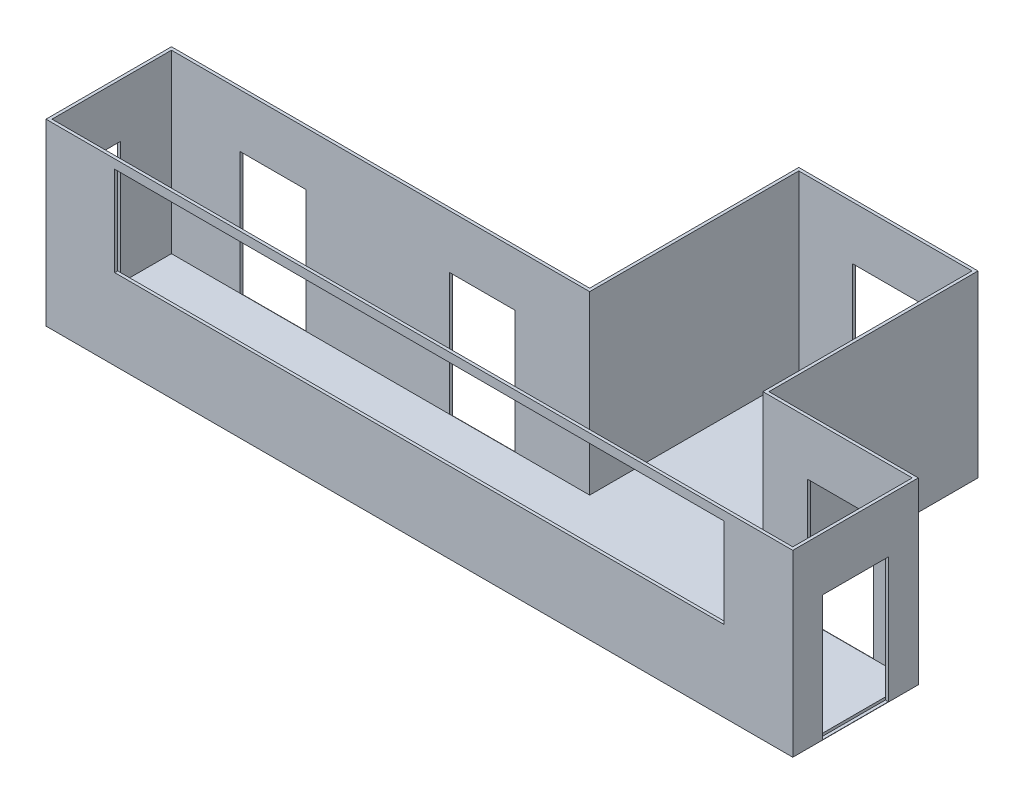
from build123d import *

# Parameters (mm, degrees)
BOSS_EXTRUDE1_DEPTH = 3000
SHELL1_T            = -50
SKETCH2_W           = 1100
SKETCH2_H           = 2100
CUT_EXTRUDE1_DEPTH  = 50
SKETCH3_W           = 1100
SKETCH3_H           = 2100
CUT_EXTRUDE2_DEPTH  = 50
SKETCH4_W           = 1100
SKETCH4_H           = 2100
CUT_EXTRUDE3_DEPTH  = 50
SKETCH5_W           = 1100
SKETCH5_H           = 2100
CUT_EXTRUDE4_DEPTH  = 50
SKETCH6_W           = 5100
SKETCH6_H           = 1500
CUT_EXTRUDE5_DEPTH  = 50
SKETCH8_W           = 1100
SKETCH8_H           = 2100
CUT_EXTRUDE6_DEPTH  = 50


with BuildPart() as part:
    # Sketch1 → Boss-Extrude1 (new body)
    with BuildSketch(Plane(origin=(0, 0, 0), x_dir=(1, 0, 0), z_dir=(0, 1, 0))):
        Polygon((4377.637130802, 49.578059072), (6877.637130802, 49.578059072), (6877.637130802, -2050.421940928), (-5622.362869198, -2050.421940928), (-5622.362869198, 49.578059072), (1377.637130802, 49.578059072), (1377.637130802, 3549.578059072), (4377.637130802, 3549.578059072), align=None)
    extrude(amount=BOSS_EXTRUDE1_DEPTH)

    # Shell1
    shell1_openings = [part.faces().sort_by_distance(p)[0] for p in [
        (1270.494273659, 3000, 200.421940928),
    ]]
    offset(amount=SHELL1_T, openings=shell1_openings, kind=Kind.INTERSECTION)

    # Sketch2 → Cut-Extrude1 (cut)
    with BuildSketch(Plane.ZY.offset(5622.362869198)):
        with Locations((1400.421940928, 1055)):
            Rectangle(SKETCH2_W, SKETCH2_H)
    extrude(amount=-CUT_EXTRUDE1_DEPTH, mode=Mode.SUBTRACT)

    # Sketch3 → Cut-Extrude2 (cut)
    with BuildSketch(Plane(origin=(0, 0, -49.578059072), x_dir=(-1, 0, 0), z_dir=(0, 0, -1))):
        with Locations((372.362869198, 1055)):
            Rectangle(SKETCH3_W, SKETCH3_H)
        with Locations((3872.362869198, 1055)):
            Rectangle(SKETCH3_W, SKETCH3_H)
    extrude(amount=-CUT_EXTRUDE2_DEPTH, mode=Mode.SUBTRACT)

    # Sketch4 → Cut-Extrude3 (cut)
    with BuildSketch(Plane(origin=(0, 0, -3549.578059072), x_dir=(-1, 0, 0), z_dir=(0, 0, -1))):
        with Locations((-2877.637130802, 1055)):
            Rectangle(SKETCH4_W, SKETCH4_H)
    extrude(amount=-CUT_EXTRUDE3_DEPTH, mode=Mode.SUBTRACT)

    # Sketch5 → Cut-Extrude4 (cut)
    with BuildSketch(Plane(origin=(0, 0, -49.578059072), x_dir=(-1, 0, 0), z_dir=(0, 0, -1))):
        with Locations((-5627.637130802, 1055)):
            Rectangle(SKETCH5_W, SKETCH5_H)
    extrude(amount=-CUT_EXTRUDE4_DEPTH, mode=Mode.SUBTRACT)

    # Sketch6 → Cut-Extrude5 (cut)
    with BuildSketch(Plane.XY.offset(2050.421940928)):
        with Locations((-1922.362869198, 2100)):
            Rectangle(SKETCH6_W, SKETCH6_H)
        with Locations((3177.637130802, 2100)):
            Rectangle(SKETCH6_W, SKETCH6_H)
    extrude(amount=-CUT_EXTRUDE5_DEPTH, mode=Mode.SUBTRACT)

    # Sketch8 → Cut-Extrude6 (cut)
    with BuildSketch(Plane(origin=(6877.637130802, 0, 0), x_dir=(0, 0, -1), z_dir=(1, 0, 0))):
        with Locations((-1000.421940928, 1055)):
            Rectangle(SKETCH8_W, SKETCH8_H)
    extrude(amount=-CUT_EXTRUDE6_DEPTH, mode=Mode.SUBTRACT)


solid = part.part
